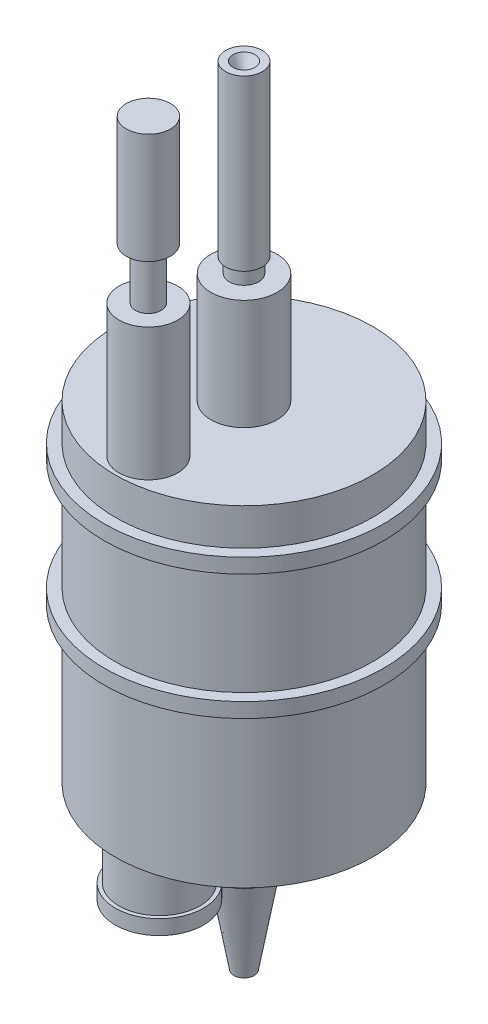
from build123d import *

# Parameters (mm, degrees)
SKETCH1_R           = 17.5
EXTRUDE1_DEPTH      = 45
SKETCH2_R           = 3.5
SKETCH2_R_2         = 5.5
EXTRUDE2_DEPTH      = 8
SKETCH3_R           = 2.5
EXTRUDE3_DEPTH      = 2
SKETCH4_R           = 3.5
EXTRUDE4_DEPTH      = 12
EXTRUDE4_TAPER      = 10
SKETCH5_R           = 6
EXTRUDE6_DEPTH      = 2
SKETCH6_R           = 4.5
EXTRUDE7_DEPTH      = 15
SKETCH7_R           = 2
EXTRUDE8_DEPTH      = 2
EXTRUDE9_START      = 23
SKETCH8_R           = 2.5
EXTRUDE9_DEPTH      = 23
SKETCH9_R           = 4
EXTRUDE10_DEPTH     = 18
SKETCH11_R          = 1.75
EXTRUDE11_DEPTH     = 7
SKETCH12_R          = 3
EXTRUDE12_DEPTH     = 15
SKETCH14_R          = 19
BOSS_EXTRUDE1_DEPTH = 2
SKETCH15_R          = 19
BOSS_EXTRUDE2_DEPTH = 2
SKETCH13_R          = 0.6
CUT_EXTRUDE1_DEPTH  = 111.322255234


with BuildPart() as part:
    # Sketch1 → Extrude1 (new body)
    with BuildSketch(Plane(origin=(0, 0, 0), x_dir=(1, 0, 0), z_dir=(0, 1, 0))):
        with Locations(Location((0, 0, 0), (0, 0, 90))):
            Circle(SKETCH1_R)
    extrude(amount=EXTRUDE1_DEPTH)

    # Sketch2 → Extrude2 (add)
    with BuildSketch(Plane.XZ):
        with Locations(Location((0, 0, 0), (0, 0, 90))):
            Circle(SKETCH2_R)
        with Locations(Location((0, 11.5, 0), (0, 0, 90))):
            Circle(SKETCH2_R_2)
    extrude(amount=EXTRUDE2_DEPTH)

    # Sketch3 → Extrude3 (add)
    with BuildSketch(Plane.XZ.offset(8)):
        with Locations(Location((0, 0, 0), (0, 0, 270))):
            Circle(SKETCH3_R)
    extrude(amount=EXTRUDE3_DEPTH)

    # Sketch5 → Extrude6 (add)
    with BuildSketch(Plane.XZ.offset(8)):
        with Locations(Location((0, 11.5, 0), (0, 0, 270))):
            Circle(SKETCH5_R)
    extrude(amount=-EXTRUDE6_DEPTH)

    # Sketch6 → Extrude7 (add)
    with BuildSketch(Plane(origin=(0, 45, 0), x_dir=(1, 0, 0), z_dir=(0, 1, 0))):
        with Locations(Location((0, 0, 0), (0, 0, 270))):
            Circle(SKETCH6_R)
    extrude(amount=EXTRUDE7_DEPTH)

    # Sketch7 → Extrude8 (add)
    with BuildSketch(Plane(origin=(0, 60, 0), x_dir=(1, 0, 0), z_dir=(0, 1, 0))):
        with Locations(Location((0, 0, 0), (0, 0, 270))):
            Circle(SKETCH7_R)
    extrude(amount=EXTRUDE8_DEPTH)

    # Sketch8 → Extrude9 (add)
    with BuildSketch(Plane(origin=(0, 62, 0), x_dir=(1, 0, 0), z_dir=(0, 1, 0)).offset(EXTRUDE9_START)):
        with Locations(Location((0, 0, 0), (0, 0, 90))):
            Circle(SKETCH8_R)
    extrude(amount=-EXTRUDE9_DEPTH)

    # Sketch9 → Extrude10 (add)
    with BuildSketch(Plane(origin=(0, 45, 0), x_dir=(1, 0, 0), z_dir=(0, 1, 0))):
        with Locations(Location((0, -13, 0), (0, 0, 270))):
            Circle(SKETCH9_R)
    extrude(amount=EXTRUDE10_DEPTH)

    # Sketch11 → Extrude11 (add)
    with BuildSketch(Plane(origin=(0, 63, 0), x_dir=(1, 0, 0), z_dir=(0, 1, 0))):
        with Locations(Location((0, -13, 0), (0, 0, 270))):
            Circle(SKETCH11_R)
    extrude(amount=EXTRUDE11_DEPTH)

    # Sketch12 → Extrude12 (add)
    with BuildSketch(Plane(origin=(0, 70, 0), x_dir=(1, 0, 0), z_dir=(0, 1, 0))):
        with Locations(Location((0, -13, 0), (0, 0, 270))):
            Circle(SKETCH12_R)
    extrude(amount=EXTRUDE12_DEPTH)

    # Sketch14 → Boss-Extrude1 (add)
    with BuildSketch(Plane(origin=(0, 40, 0), x_dir=(-1, 0, 0), z_dir=(0, 1, 0))):
        with Locations(Location((0, 0, 0), (0, 0, 90))):
            Circle(SKETCH14_R)
    extrude(amount=-BOSS_EXTRUDE1_DEPTH)

    # Sketch15 → Boss-Extrude2 (add)
    with BuildSketch(Plane.XZ.offset(-23)):
        with Locations(Location((0, 0, 0), (0, 0, 90))):
            Circle(SKETCH15_R)
    extrude(amount=BOSS_EXTRUDE2_DEPTH)


with BuildPart() as body_2:
    # Sketch4 → Extrude4 (new body)
    with BuildSketch(Plane.XZ.offset(10)):
        with Locations(Location((0, 0, 0), (0, 0, 90))):
            Circle(SKETCH4_R)
    extrude(amount=EXTRUDE4_DEPTH, taper=EXTRUDE4_TAPER)


with BuildPart() as cut_extrude1_tool:
    # Sketch13 → Cut-Extrude1 (new, through all)
    with BuildSketch(Plane.XZ.offset(22)):
        with Locations(Location((0, 0, 0), (0, 0, 270))):
            Circle(SKETCH13_R)
    extrude(amount=-CUT_EXTRUDE1_DEPTH)


with BuildPart() as part_1:
    add(part.part)

    # Cut-Extrude1: cut by cut_extrude1_tool
    add(cut_extrude1_tool.part, mode=Mode.SUBTRACT)

    # Cut-Extrude2 cone 1 section (through the dimple's axis) → Cut-Extrude2 (revolve, cut)
    with BuildSketch(Plane(origin=(0, 85, 0), x_dir=(0, 0, 1), z_dir=(1, 0, 0))):
        Polygon((0, 0), (1.5, 0), (0, 2.598076211), align=None)
    revolve(axis=Axis((0, 85, 0), (0, -1, 0)), mode=Mode.SUBTRACT)


with BuildPart() as body_2_1:
    add(body_2.part)

    # Cut-Extrude1: cut by cut_extrude1_tool
    add(cut_extrude1_tool.part, mode=Mode.SUBTRACT)


solid = Compound([part_1.part, body_2_1.part])
